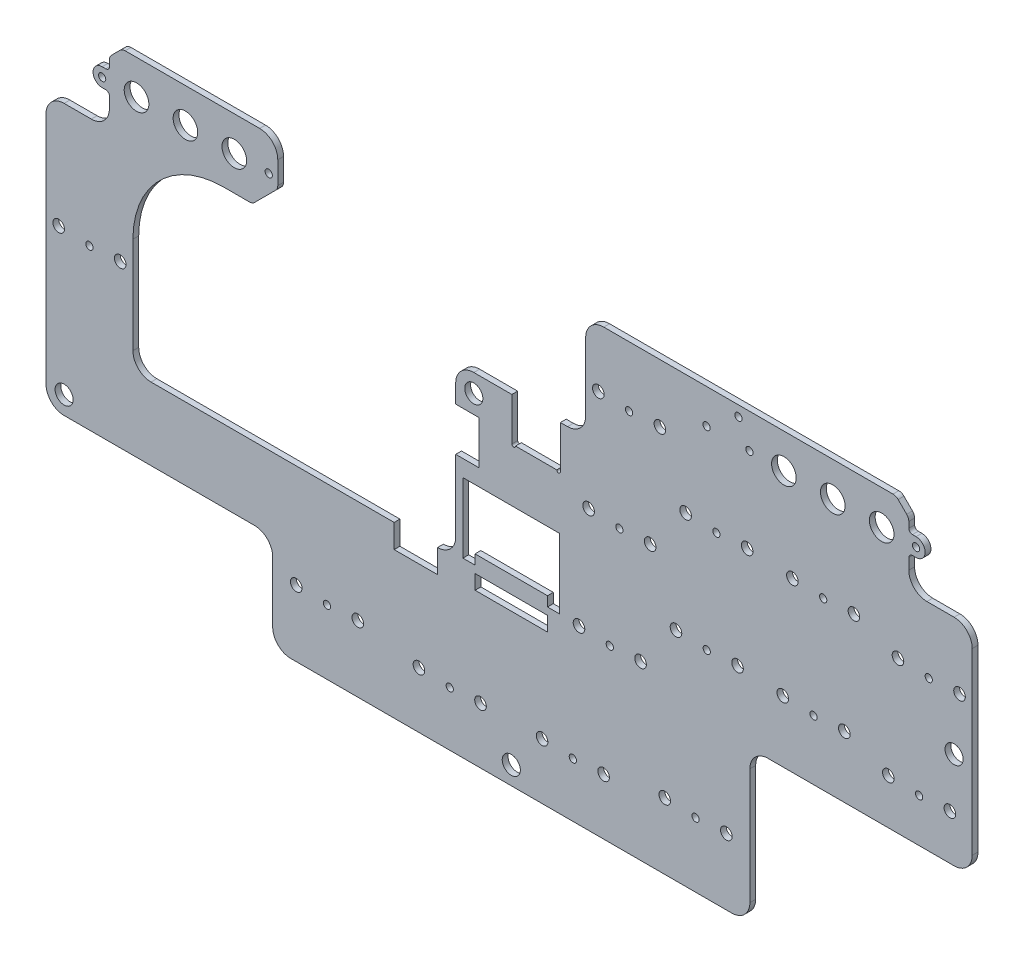
from build123d import *

# Parameters (mm, degrees)
SKETCH18_R          = 2.5
BOSS_EXTRUDE1_DEPTH = 1.6
SKETCH6_R           = 3.4
CUT_EXTRUDE1_DEPTH  = 300.671737188
SKETCH25_R          = 1
CUT_EXTRUDE2_DEPTH  = 300.671737188
SKETCH16_R          = 1.6
CUT_EXTRUDE3_DEPTH  = 300.671737188
SKETCH3_W           = 19.993534169
SKETCH3_H           = 4
CUT_EXTRUDE4_DEPTH  = 1.6
CUT_EXTRUDE6_DEPTH  = 300.671737188
SKETCH22_W          = 6.5
SKETCH22_H          = 12
SKETCH22_W_2        = 12
SKETCH22_H_2        = 6.5
CUT_EXTRUDE7_DEPTH  = 300.671737188


with BuildPart() as part:
    # Sketch18 → Boss-Extrude1 (new body)
    with BuildSketch(Plane.XY):
        with BuildLine():
            Line((125.541946024, 99.938694526), (125.541946024, 63.085390407))
            ThreePointArc((125.541946024, 63.085390407), (124.07747993, 59.549856501), (120.541946024, 58.085390407))
            Line((120.541946024, 58.085390407), (41.41186441, 58.085390407))
            ThreePointArc((41.41186441, 58.085390407), (37.876330504, 59.549856501), (36.41186441, 63.085390407))
            Line((36.41186441, 63.085390407), (36.41186441, 89.738694526))
            ThreePointArc((36.41186441, 89.738694526), (43.73419488, 107.416364055), (61.41186441, 114.738694526))
            Line((61.41186441, 114.738694526), (68.583437285, 114.738694526))
            ThreePointArc((68.583437285, 114.738694526), (69.34880415, 114.890935461), (69.997650848, 115.324480963))
            Line((69.997650848, 115.324480963), (75.826077972, 121.152908088))
            ThreePointArc((75.826077972, 121.152908088), (76.259623475, 121.801754786), (76.41186441, 122.56712165))
            Line((76.41186441, 122.56712165), (76.41186441, 128.738694526))
            ThreePointArc((76.41186441, 128.738694526), (74.947398316, 132.274228432), (71.41186441, 133.738694526))
            Line((71.41186441, 133.738694526), (34.275825441, 133.738694526))
            ThreePointArc((34.275825441, 133.738694526), (33.510458576, 133.586453591), (32.861611878, 133.152908088))
            Line((32.861611878, 133.152908088), (30.508058488, 130.799354697))
            ThreePointArc((30.508058488, 130.799354697), (30.074512985, 130.150508), (29.92227205, 129.385141135))
            Line((29.92227205, 129.385141135), (29.92227205, 127.738694526))
            ThreePointArc((29.92227205, 127.738694526), (29.629378831, 127.031587745), (28.92227205, 126.738694526))
            Line((28.92227205, 126.738694526), (27.91186441, 126.738694526))
            ThreePointArc((27.91186441, 126.738694526), (25.41186441, 124.238694526), (27.91186441, 121.738694526))
            Line((27.91186441, 121.738694526), (28.92227205, 121.738694526))
            ThreePointArc((28.92227205, 121.738694526), (29.629378831, 121.445801307), (29.92227205, 120.738694526))
            Line((29.92227205, 120.738694526), (29.92227205, 117.728286886))
            ThreePointArc((29.92227205, 117.728286886), (28.457805956, 114.19275298), (24.92227205, 112.728286886))
            Line((24.92227205, 112.728286886), (17.41186441, 112.728286886))
            ThreePointArc((17.41186441, 112.728286886), (13.876330504, 111.263820792), (12.41186441, 107.728286886))
            Line((12.41186441, 107.728286886), (12.41186441, 43.085390407))
            ThreePointArc((12.41186441, 43.085390407), (13.876330504, 39.549856501), (17.41186441, 38.085390407))
            Line((17.41186441, 38.085390407), (70.009210849, 38.085390407))
            ThreePointArc((70.009210849, 38.085390407), (73.544744755, 36.620924313), (75.009210849, 33.085390407))
            Line((75.009210849, 33.085390407), (75.009210849, 16.270067852))
            ThreePointArc((75.009210849, 16.270067852), (76.473676943, 12.734533946), (80.009210849, 11.270067852))
            Line((80.009210849, 11.270067852), (201.774681199, 11.270067852))
            ThreePointArc((201.774681199, 11.270067852), (205.310215105, 12.734533946), (206.774681199, 16.270067852))
            Line((206.774681199, 16.270067852), (206.774681199, 48.274150291))
            ThreePointArc((206.774681199, 48.274150291), (208.239147293, 51.809684196), (211.774681199, 53.274150291))
            Line((211.774681199, 53.274150291), (263.168886442, 53.274150291))
            ThreePointArc((263.168886442, 53.274150291), (266.704420348, 54.738616385), (268.168886442, 58.274150291))
            Line((268.168886442, 58.274150291), (268.168886442, 107.728286886))
            ThreePointArc((268.168886442, 107.728286886), (266.704420348, 111.263820792), (263.168886442, 112.728286886))
            Line((263.168886442, 112.728286886), (255.658478802, 112.728286886))
            ThreePointArc((255.658478802, 112.728286886), (252.122944896, 114.19275298), (250.658478802, 117.728286886))
            Line((250.658478802, 117.728286886), (250.658478802, 120.738694526))
            ThreePointArc((250.658478802, 120.738694526), (250.951372021, 121.445801307), (251.658478802, 121.738694526))
            Line((251.658478802, 121.738694526), (252.668886442, 121.738694526))
            ThreePointArc((252.668886442, 121.738694526), (255.168886442, 124.238694526), (252.668886442, 126.738694526))
            Line((252.668886442, 126.738694526), (251.658478802, 126.738694526))
            ThreePointArc((251.658478802, 126.738694526), (250.951372021, 127.031587745), (250.658478802, 127.738694526))
            Line((250.658478802, 127.738694526), (250.658478802, 129.385141135))
            ThreePointArc((250.658478802, 129.385141135), (250.506237867, 130.150508), (250.072692364, 130.799354697))
            Line((250.072692364, 130.799354697), (247.719138974, 133.152908088))
            ThreePointArc((247.719138974, 133.152908088), (247.070292276, 133.586453591), (246.304925411, 133.738694526))
            Line((246.304925411, 133.738694526), (166.429012786, 133.738694526))
            ThreePointArc((166.429012786, 133.738694526), (162.893478881, 132.274228432), (161.429012786, 128.738694526))
            Line((161.429012786, 128.738694526), (161.429012786, 109.938694526))
            ThreePointArc((161.429012786, 109.938694526), (159.964546692, 106.40316062), (156.429012786, 104.938694526))
            Line((156.429012786, 104.938694526), (130.541946024, 104.938694526))
            ThreePointArc((130.541946024, 104.938694526), (127.006412118, 103.474228432), (125.541946024, 99.938694526))
        make_face()
        with Locations((17.41186441, 43.085390407)):
            Circle(SKETCH18_R, mode=Mode.SUBTRACT)
        with Locations((140.891946024, 16.270067852)):
            Circle(SKETCH18_R, mode=Mode.SUBTRACT)
        with Locations((130.541946024, 99.938694526)):
            Circle(SKETCH18_R, mode=Mode.SUBTRACT)
        with Locations((263.168886442, 79.964143119)):
            Circle(SKETCH18_R, mode=Mode.SUBTRACT)
    extrude(amount=-BOSS_EXTRUDE1_DEPTH)

    # Sketch6 → Cut-Extrude1 (cut, through all)
    with BuildSketch(Plane.XY):
        with Locations((37.41186441, 124.238694526)):
            Circle(SKETCH6_R)
        with Locations((50.91186441, 124.238694526)):
            Circle(SKETCH6_R)
        with Locations((64.41186441, 124.238694526)):
            Circle(SKETCH6_R)
        with Locations((243.168886442, 124.238694526)):
            Circle(SKETCH6_R)
        with Locations((229.668886442, 124.238694526)):
            Circle(SKETCH6_R)
        with Locations((216.168886442, 124.238694526)):
            Circle(SKETCH6_R)
    extrude(amount=-CUT_EXTRUDE1_DEPTH, mode=Mode.SUBTRACT)

    # Sketch25 → Cut-Extrude2 (cut, through all)
    with BuildSketch(Plane.XY):
        with Locations((27.91186441, 124.238694526)):
            Circle(SKETCH25_R)
        with Locations((73.91186441, 124.238694526)):
            Circle(SKETCH25_R)
        with Locations((24.41186441, 82.179064133)):
            Circle(SKETCH25_R)
        with Locations((90.009210849, 29.091460603)):
            Circle(SKETCH25_R)
        with Locations((123.891946024, 26.270067852)):
            Circle(SKETCH25_R)
        with Locations((157.891946024, 26.270067852)):
            Circle(SKETCH25_R)
        with Locations((191.774681199, 29.091460603)):
            Circle(SKETCH25_R)
        with Locations((168.091946024, 58.360067852)):
            Circle(SKETCH25_R)
        with Locations((170.75022418, 87.740053509)):
            Circle(SKETCH25_R)
        with Locations((194.873540874, 70.729230202)):
            Circle(SKETCH25_R)
        with Locations((224.358659158, 69.792320505)):
            Circle(SKETCH25_R)
        with Locations((253.510608286, 65.274150291)):
            Circle(SKETCH25_R)
        with Locations((256.168886442, 94.654135948)):
            Circle(SKETCH25_R)
        with Locations((227.016937315, 99.172306162)):
            Circle(SKETCH25_R)
        with Locations((197.531819031, 100.10921586)):
            Circle(SKETCH25_R)
        with Locations((173.429012786, 117.118176179)):
            Circle(SKETCH25_R)
        with Locations((206.668886442, 124.238694526)):
            Circle(SKETCH25_R)
        with Locations((252.668886442, 124.238694526)):
            Circle(SKETCH25_R)
        with Locations((194.798949614, 124.238694526)):
            Circle(SKETCH25_R)
        with Locations((203.608918028, 130.863694526)):
            Circle(SKETCH25_R)
    extrude(amount=-CUT_EXTRUDE2_DEPTH, mode=Mode.SUBTRACT)

    # Sketch16 → Cut-Extrude3 (cut, through all)
    with BuildSketch(Plane.XY):
        with Locations((15.91186441, 82.679064133)):
            Circle(SKETCH16_R)
        with Locations((32.91186441, 82.679064133)):
            Circle(SKETCH16_R)
        with Locations((81.509210849, 29.591460603)):
            Circle(SKETCH16_R)
        with Locations((98.509210849, 29.591460603)):
            Circle(SKETCH16_R)
        with Locations((115.391946024, 26.770067852)):
            Circle(SKETCH16_R)
        with Locations((132.391946024, 26.770067852)):
            Circle(SKETCH16_R)
        with Locations((149.391946024, 26.770067852)):
            Circle(SKETCH16_R)
        with Locations((166.391946024, 26.770067852)):
            Circle(SKETCH16_R)
        with Locations((183.274681199, 29.591460603)):
            Circle(SKETCH16_R)
        with Locations((200.274681199, 29.591460603)):
            Circle(SKETCH16_R)
        with Locations((164.929012786, 117.618176179)):
            Circle(SKETCH16_R)
        with Locations((181.929012786, 117.618176179)):
            Circle(SKETCH16_R)
        with Locations((162.25022418, 88.240053509)):
            Circle(SKETCH16_R)
        with Locations((179.25022418, 88.240053509)):
            Circle(SKETCH16_R)
        with Locations((189.031819031, 100.60921586)):
            Circle(SKETCH16_R)
        with Locations((206.031819031, 100.60921586)):
            Circle(SKETCH16_R)
        with Locations((159.591946024, 58.860067852)):
            Circle(SKETCH16_R)
        with Locations((176.591946024, 58.860067852)):
            Circle(SKETCH16_R)
        with Locations((186.373540874, 71.229230202)):
            Circle(SKETCH16_R)
        with Locations((203.373540874, 71.229230202)):
            Circle(SKETCH16_R)
        with Locations((218.516937315, 99.672306162)):
            Circle(SKETCH16_R)
        with Locations((235.516937315, 99.672306162)):
            Circle(SKETCH16_R)
        with Locations((215.858659158, 70.292320505)):
            Circle(SKETCH16_R)
        with Locations((232.858659158, 70.292320505)):
            Circle(SKETCH16_R)
        with Locations((247.668886442, 95.154135948)):
            Circle(SKETCH16_R)
        with Locations((264.668886442, 95.154135948)):
            Circle(SKETCH16_R)
        with Locations((245.010608286, 65.774150291)):
            Circle(SKETCH16_R)
        with Locations((262.010608286, 65.774150291)):
            Circle(SKETCH16_R)
    extrude(amount=-CUT_EXTRUDE3_DEPTH, mode=Mode.SUBTRACT)

    # Sketch3 → Cut-Extrude4 (cut)
    with BuildSketch(Plane.XY):
        with Locations((140.891946023, 55.034534541)):
            Rectangle(SKETCH3_W, SKETCH3_H)
        Polygon((127.541946024, 59.034534541), (130.891946024, 59.034534541), (130.891946024, 61.734534541), (150.891946024, 61.734534541), (150.891946024, 59.034534541), (154.241946024, 59.034534541), (154.241946024, 78.294534541), (127.541946024, 78.294534541), align=None)
    extrude(amount=-CUT_EXTRUDE4_DEPTH, mode=Mode.SUBTRACT)

    # Sketch26 → Cut-Extrude6 (cut, through all)
    with BuildSketch(Plane.XY):
        with BuildLine():
            Line((141.05540719, 104.938694526), (141.05540719, 93.108694526))
            ThreePointArc((141.05540719, 93.108694526), (141.55540719, 92.608694526), (142.05540719, 93.108694526))
            Line((142.05540719, 93.108694526), (153.45540719, 93.108694526))
            ThreePointArc((153.45540719, 93.108694526), (153.95540719, 92.608694526), (154.45540719, 93.108694526))
            Line((154.45540719, 93.108694526), (154.45540719, 104.938694526))
            Line((154.45540719, 104.938694526), (141.05540719, 104.938694526))
        make_face()
    extrude(amount=-CUT_EXTRUDE6_DEPTH, mode=Mode.SUBTRACT)

    # Sketch22 → Cut-Extrude7 (cut, through all)
    with BuildSketch(Plane.XY):
        with Locations((128.791946024, 88.866614533)):
            Rectangle(SKETCH22_W, SKETCH22_H)
        with Locations((114.541946024, 54.835390407)):
            Rectangle(SKETCH22_W_2, SKETCH22_H_2)
    extrude(amount=-CUT_EXTRUDE7_DEPTH, mode=Mode.SUBTRACT)


solid = part.part
